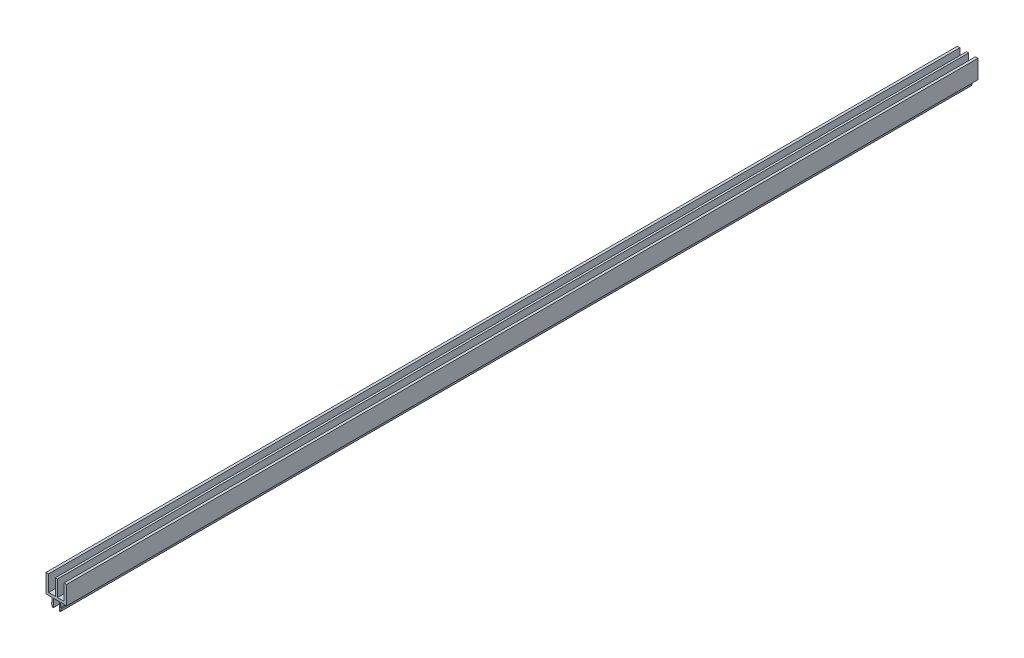
from build123d import *

# Parameters (mm, degrees)
BOSS_EXTRU_1_DEPTH = 879


with BuildPart() as part:
    # Esquisse1 → Boss.-Extru.1 (new body)
    with BuildSketch(Plane.XY.offset(50)):
        Polygon((-1, 2.5), (-7.5, 2.5), (-7.5, 17.999999998), (-10, 17.999999998), (-10, 0), (-4, 0), (-4, -4.5), (-5, -4.5), (-3.75, -8), (-3, -8), (-3, 0), (3, 0), (3, -8), (3.75, -8), (5, -4.5), (4, -4.5), (4, 0), (10, 0), (10, 17.999999998), (7.5, 17.999999998), (7.5, 2.5), (1, 2.5), (1, 17.999999998), (-1, 17.999999998), align=None)
    extrude(amount=-BOSS_EXTRU_1_DEPTH)


solid = part.part
